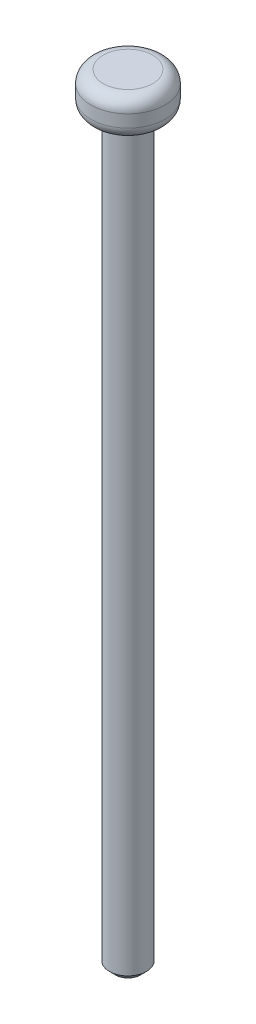
from build123d import *

# Parameters (mm, degrees)
FILLET1_R     = 0.1
CHAMFER1_SIZE = 0.05


with BuildPart() as part:
    # Sketch2 → Revolve1 (revolve)
    with BuildSketch(Plane.XY, mode=Mode.PRIVATE) as revolve1_sk:
        Polygon((0, 0), (0.15, 0), (0.15, 6), (0.3, 6), (0.3, 6.3), (0, 6.3), align=None)
    revolve(revolve1_sk.sketch.rotate(Axis((0, 6.3, 0), (0, -1, 0)), 180), axis=Axis((0, 6.3, 0), (0, -1, 0)))

    # Fillet1
    fillet1_edges = [part.edges().sort_by_distance(p)[0] for p in [
        (0.3, 6.3, 0),
        (0.3, 6, 0),
    ]]
    fillet(fillet1_edges, radius=FILLET1_R)

    # Chamfer1
    chamfer1_edges = [part.edges().sort_by_distance(p)[0] for p in [
        (0.15, 0, 0),
    ]]
    chamfer(chamfer1_edges, length=CHAMFER1_SIZE)


solid = part.part
